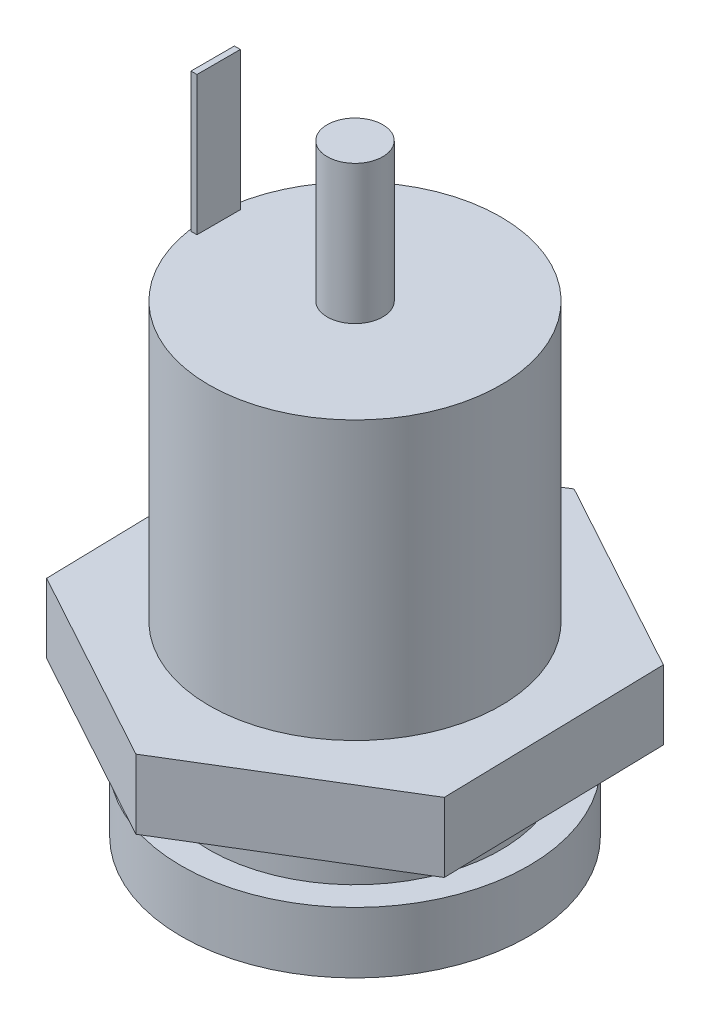
from build123d import *

# Parameters (mm, degrees)
SKETCH_1_R          = 5.25
EXTRUDE_1_DEPTH     = 14.5
SKETCH_2_R          = 1
SKETCH_2_W          = 0.21481542
SKETCH_2_H          = 1.562293966
EXTRUDE_2_DEPTH     = 5
SKETCH_3_R          = 6.25
EXTRUDE_3_DEPTH     = 2.2
EXTRUDE_START       = 2
EXTRUDE_4_DEPTH     = 2.5
SKETCH_5_R          = 2.25
CUT_EXTRUDE_1_DEPTH = 11


with BuildPart() as part:
    # Эскиз1 → Бобышка-Вытянуть1 (new body)
    with BuildSketch(Plane(origin=(0, 0, 0), x_dir=(1, 0, 0), z_dir=(0, 1, 0))):
        with Locations(Location((0, 0, 0), (0, 0, 90))):
            Circle(SKETCH_1_R)
    extrude(amount=EXTRUDE_1_DEPTH)

    # Эскиз2 → Бобышка-Вытянуть2 (add)
    with BuildSketch(Plane(origin=(0, 14.5, 0), x_dir=(1, 0, 0), z_dir=(0, 1, 0))):
        with Locations(Location((0, 0, 0), (0, 0, 270))):
            Circle(SKETCH_2_R)
        with Locations((-5.018869364, 0)):
            Rectangle(SKETCH_2_W, SKETCH_2_H)
    extrude(amount=EXTRUDE_2_DEPTH)

    # Эскиз3 → Бобышка-Вытянуть3 (add)
    with BuildSketch(Plane.XZ):
        with Locations(Location((0, 0, 0), (0, 0, 270))):
            Circle(SKETCH_3_R)
    extrude(amount=EXTRUDE_3_DEPTH)

    # Эскиз4 → Бобышка-Вытянуть4 (add)
    with BuildSketch(Plane(origin=(0, 0, 0), x_dir=(1, 0, 0), z_dir=(0, 1, 0)).offset(EXTRUDE_START)):
        Polygon((7.092328416, -3.877139534), (6.903865539, 4.203566813), (-0.188462877, 8.080706348), (-7.092328416, 3.877139534), (-6.903865539, -4.203566813), (0.188462877, -8.080706348), align=None)
    extrude(amount=EXTRUDE_4_DEPTH)

    # Эскиз5 → Вырез-Вытянуть1 (cut)
    with BuildSketch(Plane.XZ.offset(2.2)):
        with Locations(Location((0, 0, 0), (0, 0, 270))):
            Circle(SKETCH_5_R)
    extrude(amount=-CUT_EXTRUDE_1_DEPTH, mode=Mode.SUBTRACT)


solid = part.part
